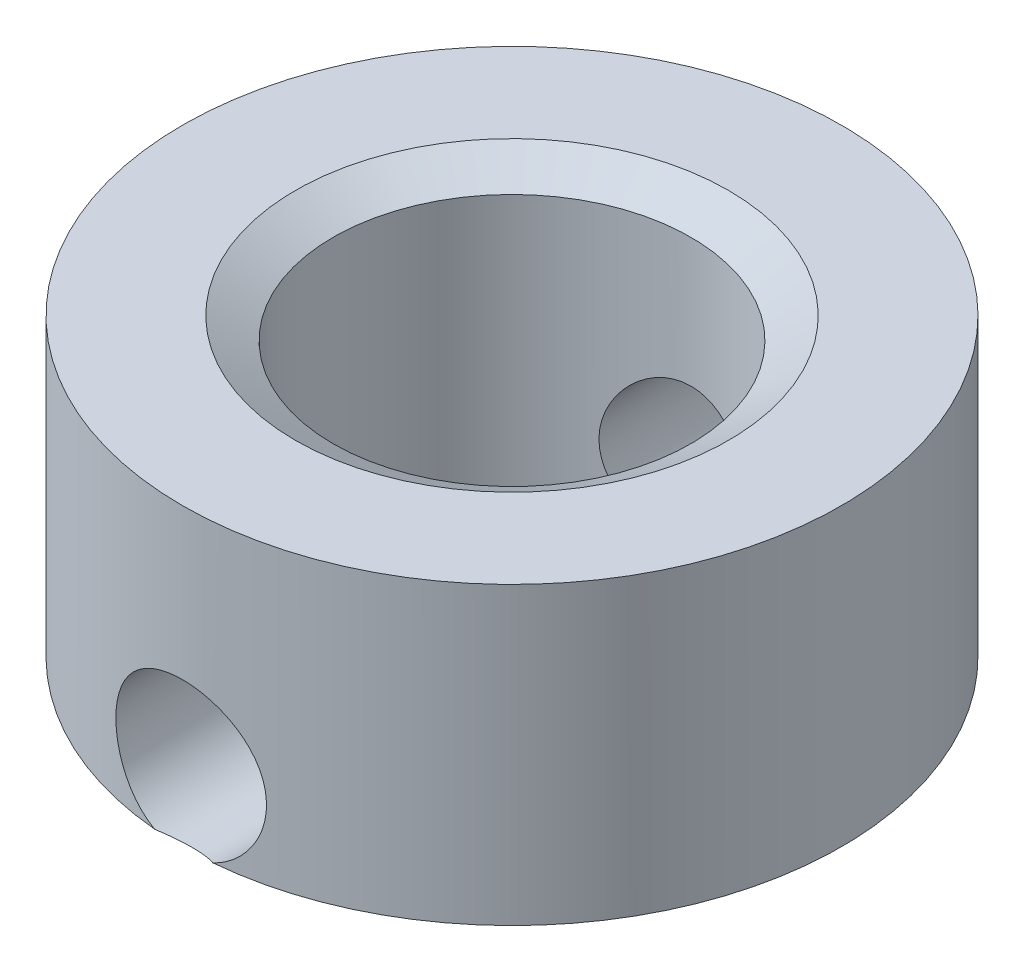
from build123d import *

# Parameters (mm, degrees)
SKETCH1_R               = 4.375
SKETCH1_R_2             = 2.375
BOSS_EXTRUDE1_DEPTH     = 4.5
CHAMFER1_SIZE           = 0.5
CHAMFER1_SIZE2          = 0.288675135
CHAMFER2_SIZE           = 1
CHAMFER2_SIZE2          = 0.577350269
CUT_EXTRUDE1_DEPTH      = 8.650571874
CUT_EXTRUDE1_DEPTH_BACK = 8.650571874
SKETCH2_R               = 1


with BuildPart() as part:
    # Sketch1 → Boss-Extrude1 (new body)
    with BuildSketch(Plane(origin=(0, 0, 0), x_dir=(1, 0, 0), z_dir=(0, 1, 0))):
        with Locations(Location((0, 0, 0), (0, 0, 270))):
            Circle(SKETCH1_R)
        with Locations(Location((0, 0, 0), (0, 0, 270))):
            Circle(SKETCH1_R_2, mode=Mode.SUBTRACT)
    extrude(amount=BOSS_EXTRUDE1_DEPTH)

    # Chamfer1
    chamfer1_edges = [part.edges().sort_by_distance(p)[0] for p in [
        (0, 4.5, -2.375),
    ]]
    chamfer1_side = [part.faces().sort_by_distance(p)[0] for p in [
        (0, 4.5, -4.251256313),
    ]]
    chamfer(chamfer1_edges, length=CHAMFER1_SIZE, length2=CHAMFER1_SIZE2, reference=chamfer1_side[0])

    # Chamfer2
    chamfer2_edges = [part.edges().sort_by_distance(p)[0] for p in [
        (0, 0, -4.375),
    ]]
    chamfer2_side = [part.faces().sort_by_distance(p)[0] for p in [
        (0, 0, -4.251256313),
    ]]
    chamfer(chamfer2_edges, length=CHAMFER2_SIZE, length2=CHAMFER2_SIZE2, reference=chamfer2_side[0])

    # Sketch2 → Cut-Extrude1 (cut, two sides: drawn at the far end of the back side and taken through both)
    with BuildSketch(Plane.XY.offset(-CUT_EXTRUDE1_DEPTH_BACK)):
        with Locations(Location((0, 1.5, 0), (0, 0, 292.683630924))):
            Circle(SKETCH2_R)
    extrude(amount=CUT_EXTRUDE1_DEPTH + CUT_EXTRUDE1_DEPTH_BACK, mode=Mode.SUBTRACT)


solid = part.part
